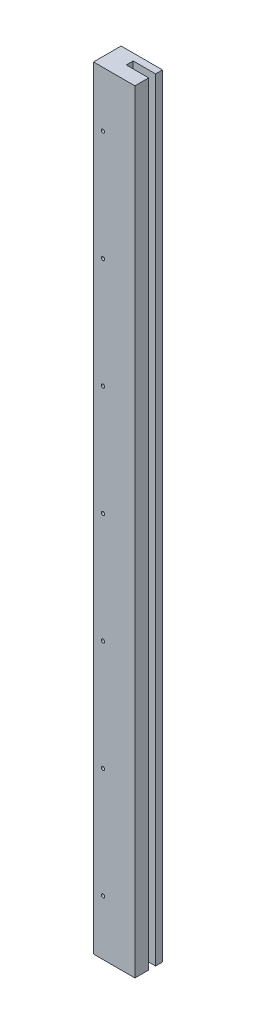
from build123d import *

# Parameters (mm, degrees)
BOSS_EXTRUDE1_DEPTH             = 711.2
SKETCH3_R                       = 3.175
SASH_ADJUSTMENT_HOLES_CUT_DEPTH = 775.037716398
LPATTERN1_COUNT                 = 6
LPATTERN1_PITCH                 = 101.6
SKETCH4_R                       = 1.5875
MOUNTING_SCREW_HOLES_CUT_DEPTH  = 857.308742511
LPATTERN2_COUNT                 = 7
LPATTERN2_PITCH                 = 101.6


with BuildPart() as part:
    # Sketch2 → Boss-Extrude1 (new body)
    with BuildSketch(Plane(origin=(0, 0, 0), x_dir=(1, 0, 0), z_dir=(0, 1, 0))):
        Polygon((-438.15, -304.8), (-438.15, -292.1), (-458.7875, -292.1), (-458.7875, -285.75), (-438.15, -285.75), (-438.15, -279.4), (-476.25, -279.4), (-476.25, -304.8), align=None)
    extrude(amount=BOSS_EXTRUDE1_DEPTH)

    # Sketch3 → Sash Adjustment Holes Cut (cut, through all)
    with BuildSketch(Plane(origin=(-458.7875, 0, 0), x_dir=(0, 0, -1), z_dir=(1, 0, 0))):
        with Locations((-288.925, 609.6)):
            Circle(SKETCH3_R)
    sash_adjustment_holes_cut = extrude(amount=-SASH_ADJUSTMENT_HOLES_CUT_DEPTH, mode=Mode.SUBTRACT)

    # LPattern1: Sash Adjustment Holes Cut ×6
    with Locations(*[(0, -i * LPATTERN1_PITCH, 0) for i in range(1, LPATTERN1_COUNT)]):
        add(sash_adjustment_holes_cut, mode=Mode.SUBTRACT)

    # Sketch4 → Mounting Screw Holes Cut (cut, through all)
    with BuildSketch(Plane.XY.offset(304.8)):
        with Locations((-467.51875, 50.8)):
            Circle(SKETCH4_R)
    mounting_screw_holes_cut = extrude(amount=-MOUNTING_SCREW_HOLES_CUT_DEPTH, mode=Mode.SUBTRACT)

    # LPattern2: Mounting Screw Holes Cut ×7
    with Locations(*[(0, i * LPATTERN2_PITCH, 0) for i in range(1, LPATTERN2_COUNT)]):
        add(mounting_screw_holes_cut, mode=Mode.SUBTRACT)


solid = part.part
